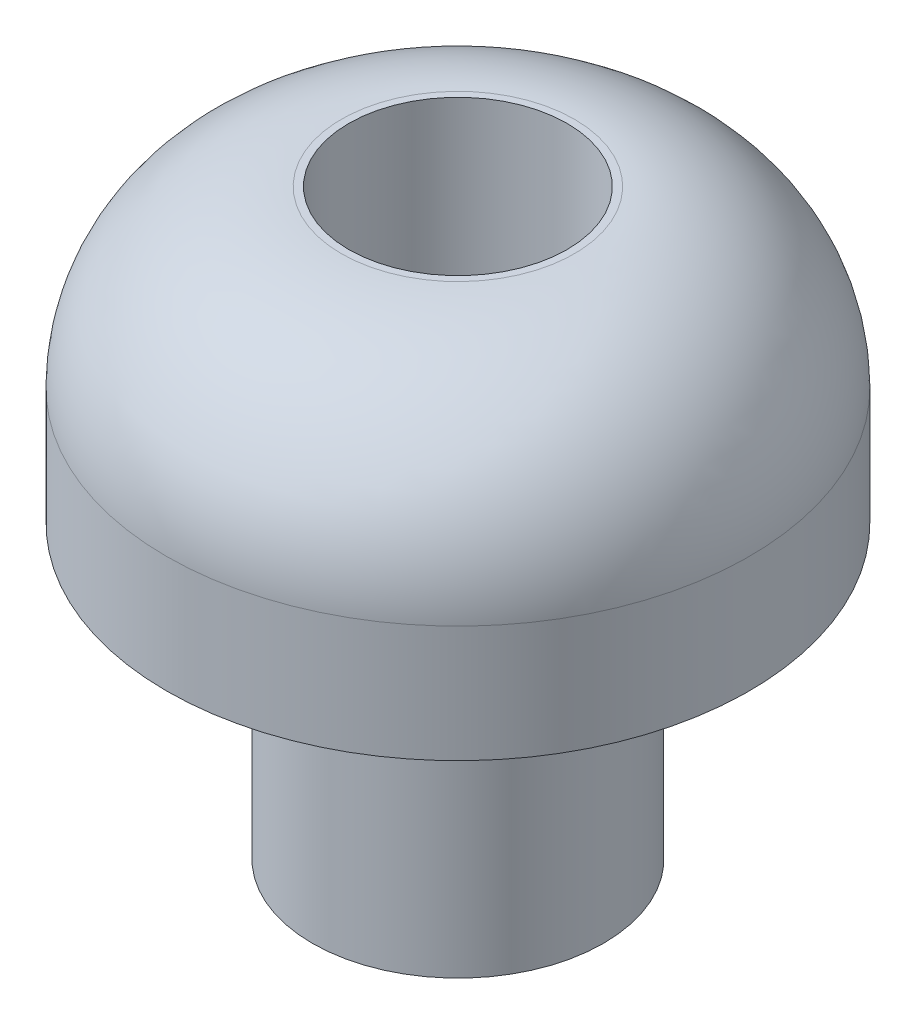
from build123d import *

# Parameters (mm, degrees)
SZKIC1_R                    = 10
DODANIE_WYCI_GNI_CIE1_DEPTH = 10
ZAOKR_GLENIE1_R             = 6
SZKIC2_R                    = 5
DODANIE_WYCI_GNI_CIE2_DEPTH = 10
SZKIC3_R                    = 3.75
WYTNIJ_WYCI_GNI_CIE1_DEPTH  = 8
WYTNIJ_WYCI_GNI_CIE2_REACH  = 26.495
SZKIC4_R                    = 1.6


with BuildPart() as part:
    # Szkic1 → Dodanie-wyciągnięcie1 (new body)
    with BuildSketch(Plane(origin=(0, 0, 0), x_dir=(1, 0, 0), z_dir=(0, 1, 0))):
        with Locations(Location((0, 0, 0), (0, 0, 270))):
            Circle(SZKIC1_R)
    extrude(amount=DODANIE_WYCI_GNI_CIE1_DEPTH)

    # Zaokrąglenie1
    zaokr_glenie1_edges = [part.edges().sort_by_distance(p)[0] for p in [
        (0, 10, -10),
    ]]
    fillet(zaokr_glenie1_edges, radius=ZAOKR_GLENIE1_R)

    # Szkic2 → Dodanie-wyciągnięcie2 (add)
    with BuildSketch(Plane.XZ):
        with Locations(Location((0, 0, 0), (0, 0, 270))):
            Circle(SZKIC2_R)
    extrude(amount=DODANIE_WYCI_GNI_CIE2_DEPTH)

    # Szkic3 → Wytnij-wyciągnięcie1 (cut)
    with BuildSketch(Plane(origin=(0, 10, 0), x_dir=(1, 0, 0), z_dir=(0, 1, 0))):
        with Locations(Location((0, 0, 0), (0, 0, 270))):
            Circle(SZKIC3_R)
    extrude(amount=-WYTNIJ_WYCI_GNI_CIE1_DEPTH, mode=Mode.SUBTRACT)

    # Szkic4 → Wytnij-wyciągnięcie2 (cut, up to next)
    with BuildSketch(Plane.XZ.offset(10), mode=Mode.PRIVATE) as wytnij_wyci_gni_cie2_sk1:
        with Locations(Location((0, 0, 0), (0, 0, 270))):
            Circle(SZKIC4_R)
    wytnij_wyci_gni_cie2_tool1 = extrude(wytnij_wyci_gni_cie2_sk1.sketch, amount=-WYTNIJ_WYCI_GNI_CIE2_REACH, mode=Mode.PRIVATE) & part.part
    add(wytnij_wyci_gni_cie2_tool1.solids().sort_by_distance((0, -10, 0))[0], mode=Mode.SUBTRACT)


solid = part.part
